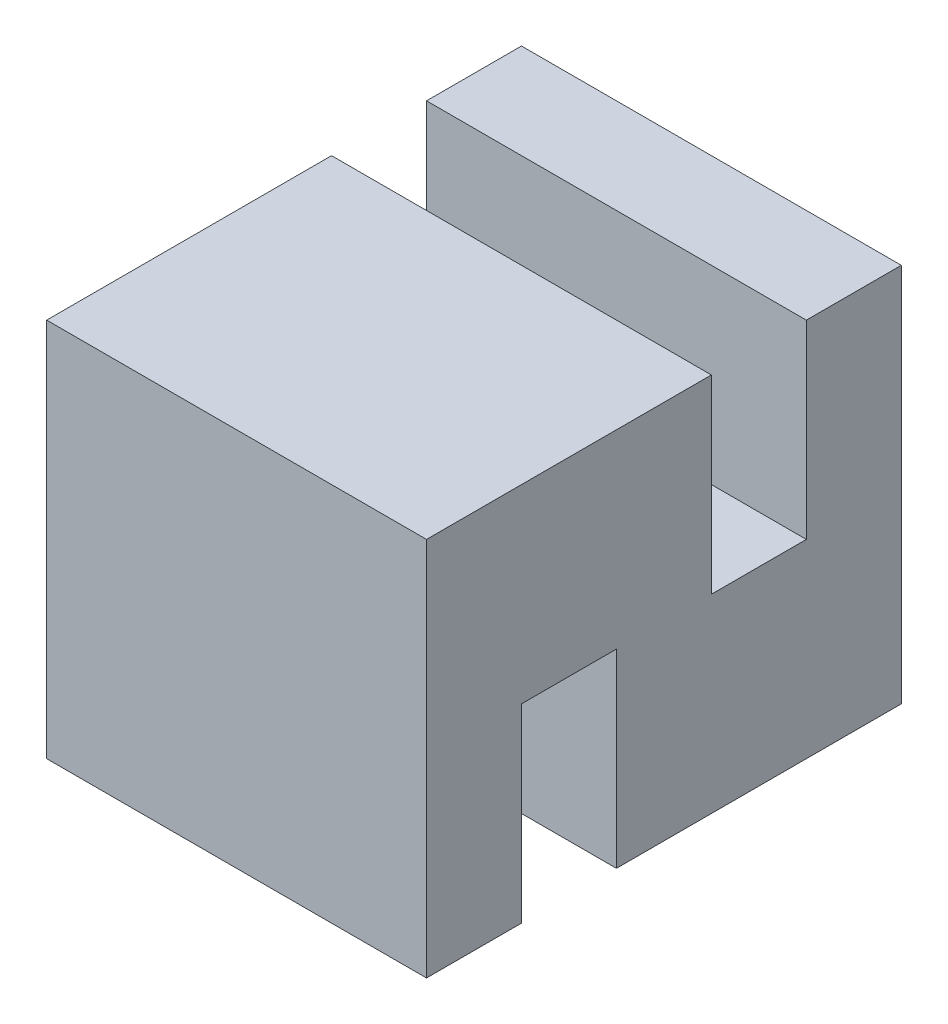
from build123d import *

# Parameters (mm, degrees)
SKETCH1_W           = 6
SKETCH1_H           = 6
BOSS_EXTRUDE1_DEPTH = 1.5
SKETCH2_W           = 6
SKETCH2_H           = 3
BOSS_EXTRUDE2_DEPTH = 1.5
SKETCH3_W           = 6
SKETCH3_H           = 6
BOSS_EXTRUDE4_DEPTH = 1.5
SKETCH4_W           = 6
SKETCH4_H           = 3
BOSS_EXTRUDE5_DEPTH = 1.5
SKETCH5_W           = 6
SKETCH5_H           = 6
BOSS_EXTRUDE6_DEPTH = 1.5


with BuildPart() as part:
    # Sketch1 → Boss-Extrude1 (new body)
    with BuildSketch(Plane.XY):
        with Locations((0, -1.5)):
            Rectangle(SKETCH1_W, SKETCH1_H)
    extrude(amount=BOSS_EXTRUDE1_DEPTH)

    # Sketch2 → Boss-Extrude2 (add)
    with BuildSketch(Plane(origin=(0, 0, 0), x_dir=(-1, 0, 0), z_dir=(0, 0, -1))):
        Rectangle(SKETCH2_W, SKETCH2_H)
    extrude(amount=BOSS_EXTRUDE2_DEPTH)

    # Sketch3 → Boss-Extrude4 (add)
    with BuildSketch(Plane(origin=(0, 0, -1.5), x_dir=(-1, 0, 0), z_dir=(0, 0, -1))):
        with Locations((0, -1.5)):
            Rectangle(SKETCH3_W, SKETCH3_H)
    extrude(amount=BOSS_EXTRUDE4_DEPTH)

    # Sketch4 → Boss-Extrude5 (add)
    with BuildSketch(Plane(origin=(0, 0, -3), x_dir=(-1, 0, 0), z_dir=(0, 0, -1))):
        with Locations((0, -3)):
            Rectangle(SKETCH4_W, SKETCH4_H)
    extrude(amount=BOSS_EXTRUDE5_DEPTH)

    # Sketch5 → Boss-Extrude6 (add)
    with BuildSketch(Plane(origin=(0, 0, -4.5), x_dir=(-1, 0, 0), z_dir=(0, 0, -1))):
        with Locations((0, -1.5)):
            Rectangle(SKETCH5_W, SKETCH5_H)
    extrude(amount=BOSS_EXTRUDE6_DEPTH)


solid = part.part
